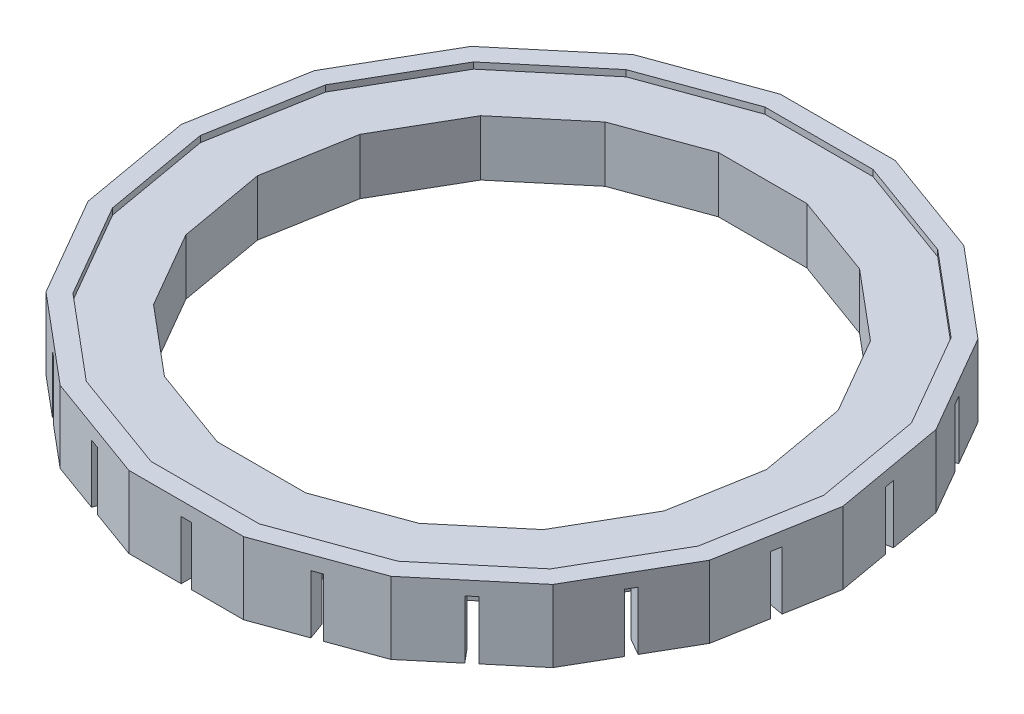
from build123d import *

# Parameters (mm, degrees)
BOSS_EXTRUDE1_DEPTH = 11.5
CUT_EXTRUDE1_DEPTH  = 11.5
CUT_EXTRUDE3_DEPTH  = 9.3
CUT_EXTRUDE4_DEPTH  = 1.6
CUT_EXTRUDE5_DEPTH  = 1


with BuildPart() as part:
    # Sketch2 → Boss-Extrude1 (new body)
    with BuildSketch(Plane(origin=(0, 0, 0), x_dir=(1, 0, 0), z_dir=(0, 1, 0))):
        Polygon((52.802183818, 0), (49.617822495, 18.059410477), (40.448819498, 33.940589523), (26.401091909, 45.728032562), (9.169002997, 52), (-9.169002997, 52), (-26.401091909, 45.728032562), (-40.448819498, 33.940589523), (-49.617822495, 18.059410477), (-52.802183818, 0), (-49.617822495, -18.059410477), (-40.448819498, -33.940589523), (-26.401091909, -45.728032562), (-9.169002997, -52), (9.169002997, -52), (26.401091909, -45.728032562), (40.448819498, -33.940589523), (49.617822495, -18.059410477), align=None)
    extrude(amount=BOSS_EXTRUDE1_DEPTH)

    # Sketch3 → Cut-Extrude1 (cut)
    with BuildSketch(Plane.XZ):
        Polygon((40.617064475, 0), (38.167555766, 13.891854213), (31.114476537, 26.108145787), (20.308532238, 35.175409663), (7.053079228, 40), (-7.053079228, 40), (-20.308532238, 35.175409663), (-31.114476537, 26.108145787), (-38.167555766, 13.891854213), (-40.617064475, 0), (-38.167555766, -13.891854213), (-31.114476537, -26.108145787), (-20.308532238, -35.175409663), (-7.053079228, -40), (7.053079228, -40), (20.308532238, -35.175409663), (31.114476537, -26.108145787), (38.167555766, -13.891854213), align=None)
    extrude(amount=-CUT_EXTRUDE1_DEPTH, mode=Mode.SUBTRACT)

    # Sketch4 → Cut-Extrude3 (cut)
    with BuildSketch(Plane.XZ):
        Polygon((-0.8, 52), (-0.8, 49), (-3.5, 49), (-3.5, 41.995317854), (3.5, 41.995317854), (3.5, 49), (0.8, 49), (0.8, 52), align=None)
        Polygon((17.033293356, 49.137632396), (16.007232926, 46.318554533), (13.47006285, 47.24200892), (11.074320459, 40.659760797), (17.652168804, 38.265619793), (20.047911196, 44.847867917), (17.51074112, 45.771322304), (18.53680155, 48.590400166), align=None)
        Polygon((32.812120149, 40.34854113), (30.88375732, 38.050407801), (28.815437324, 39.785934347), (24.31291443, 34.420036513), (29.675225532, 29.920523245), (34.177748426, 35.286421079), (32.109428429, 37.021947625), (34.037791258, 39.320080954), align=None)
        Polygon((44.633320997, 26.692820323), (42.035244785, 25.192820323), (40.685244785, 27.531088913), (34.619012102, 24.02874784), (38.119012102, 17.966570014), (44.185244785, 21.468911087), (42.835244785, 23.807179677), (45.433320997, 25.307179677), align=None)
        Polygon((51.071084615, 9.817551441), (48.116661355, 9.296606908), (47.647811276, 11.955587841), (40.749545991, 10.739237551), (41.965083235, 3.84558328), (48.863348519, 5.06193357), (48.39449844, 7.720914503), (51.348921699, 8.241859036), align=None)
        Polygon((51.348921699, -8.241859036), (48.39449844, -7.720914503), (48.863348519, -5.06193357), (41.965083235, -3.84558328), (40.749545991, -10.739237551), (47.647811276, -11.955587841), (48.116661355, -9.296606908), (51.071084615, -9.817551441), align=None)
        Polygon((45.433320997, -25.307179677), (42.835244785, -23.807179677), (44.185244785, -21.468911087), (38.119012102, -17.966570014), (34.619012102, -24.02874784), (40.685244785, -27.531088913), (42.035244785, -25.192820323), (44.633320997, -26.692820323), align=None)
        Polygon((34.037791258, -39.320080954), (32.109428429, -37.021947625), (34.177748426, -35.286421079), (29.675225532, -29.920523245), (24.31291443, -34.420036513), (28.815437324, -39.785934347), (30.88375732, -38.050407801), (32.812120149, -40.34854113), align=None)
        Polygon((18.53680155, -48.590400166), (17.51074112, -45.771322304), (20.047911196, -44.847867917), (17.652168804, -38.265619793), (11.074320459, -40.659760797), (13.47006285, -47.24200892), (16.007232926, -46.318554533), (17.033293356, -49.137632396), align=None)
        Polygon((0.8, -52), (0.8, -49), (3.5, -49), (3.5, -41.995317854), (-3.5, -41.995317854), (-3.5, -49), (-0.8, -49), (-0.8, -52), align=None)
        Polygon((-17.033293356, -49.137632396), (-16.007232926, -46.318554533), (-13.47006285, -47.24200892), (-11.074320459, -40.659760797), (-17.652168804, -38.265619793), (-20.047911196, -44.847867917), (-17.51074112, -45.771322304), (-18.53680155, -48.590400166), align=None)
        Polygon((-32.812120149, -40.34854113), (-30.88375732, -38.050407801), (-28.815437324, -39.785934347), (-24.31291443, -34.420036513), (-29.675225532, -29.920523245), (-34.177748426, -35.286421079), (-32.109428429, -37.021947625), (-34.037791258, -39.320080954), align=None)
        Polygon((-44.633320997, -26.692820323), (-42.035244785, -25.192820323), (-40.685244785, -27.531088913), (-34.619012102, -24.02874784), (-38.119012102, -17.966570014), (-44.185244785, -21.468911087), (-42.835244785, -23.807179677), (-45.433320997, -25.307179677), align=None)
        Polygon((-51.071084615, -9.817551441), (-48.116661355, -9.296606908), (-47.647811276, -11.955587841), (-40.749545991, -10.739237551), (-41.965083235, -3.84558328), (-48.863348519, -5.06193357), (-48.39449844, -7.720914503), (-51.348921699, -8.241859036), align=None)
        Polygon((-51.348921699, 8.241859036), (-48.39449844, 7.720914503), (-48.863348519, 5.06193357), (-41.965083235, 3.84558328), (-40.749545991, 10.739237551), (-47.647811276, 11.955587841), (-48.116661355, 9.296606908), (-51.071084615, 9.817551441), align=None)
        Polygon((-45.433320997, 25.307179677), (-42.835244785, 23.807179677), (-44.185244785, 21.468911087), (-38.119012102, 17.966570014), (-34.619012102, 24.02874784), (-40.685244785, 27.531088913), (-42.035244785, 25.192820323), (-44.633320997, 26.692820323), align=None)
        Polygon((-34.037791258, 39.320080954), (-32.109428429, 37.021947625), (-34.177748426, 35.286421079), (-29.675225532, 29.920523245), (-24.31291443, 34.420036513), (-28.815437324, 39.785934347), (-30.88375732, 38.050407801), (-32.812120149, 40.34854113), align=None)
        Polygon((-18.53680155, 48.590400166), (-17.51074112, 45.771322304), (-20.047911196, 44.847867917), (-17.652168804, 38.265619793), (-11.074320459, 40.659760797), (-13.47006285, 47.24200892), (-16.007232926, 46.318554533), (-17.033293356, 49.137632396), align=None)
    extrude(amount=-CUT_EXTRUDE3_DEPTH, mode=Mode.SUBTRACT)

    # Sketch5 → Cut-Extrude4 (cut)
    with BuildSketch(Plane.XZ):
        Polygon((49.75, 0), (46.749707884, 17.01550213), (38.110711045, 31.978683582), (24.875, 43.084763838), (8.638996839, 48.994185712), (-8.638996839, 48.994185712), (-24.875, 43.084763838), (-38.110711045, 31.978683582), (-46.749707884, 17.01550213), (-49.75, 0), (-46.749707884, -17.01550213), (-38.110711045, -31.978683582), (-24.875, -43.084763838), (-8.638996839, -48.994185712), (8.638996839, -48.994185712), (24.875, -43.084763838), (38.110711045, -31.978683582), (46.749707884, -17.01550213), align=None)
    extrude(amount=-CUT_EXTRUDE4_DEPTH, mode=Mode.SUBTRACT)

    # Sketch6 → Cut-Extrude5 (cut)
    with BuildSketch(Plane(origin=(0, 11.5, 0), x_dir=(1, 0, 0), z_dir=(0, 1, 0))):
        Polygon((49.75, 0), (46.749707884, 17.01550213), (38.110711045, 31.978683582), (24.875, 43.084763838), (8.638996839, 48.994185712), (-8.638996839, 48.994185712), (-24.875, 43.084763838), (-38.110711045, 31.978683582), (-46.749707884, 17.01550213), (-49.75, 0), (-46.749707884, -17.01550213), (-38.110711045, -31.978683582), (-24.875, -43.084763838), (-8.638996839, -48.994185712), (8.638996839, -48.994185712), (24.875, -43.084763838), (38.110711045, -31.978683582), (46.749707884, -17.01550213), align=None)
    extrude(amount=-CUT_EXTRUDE5_DEPTH, mode=Mode.SUBTRACT)


solid = part.part
